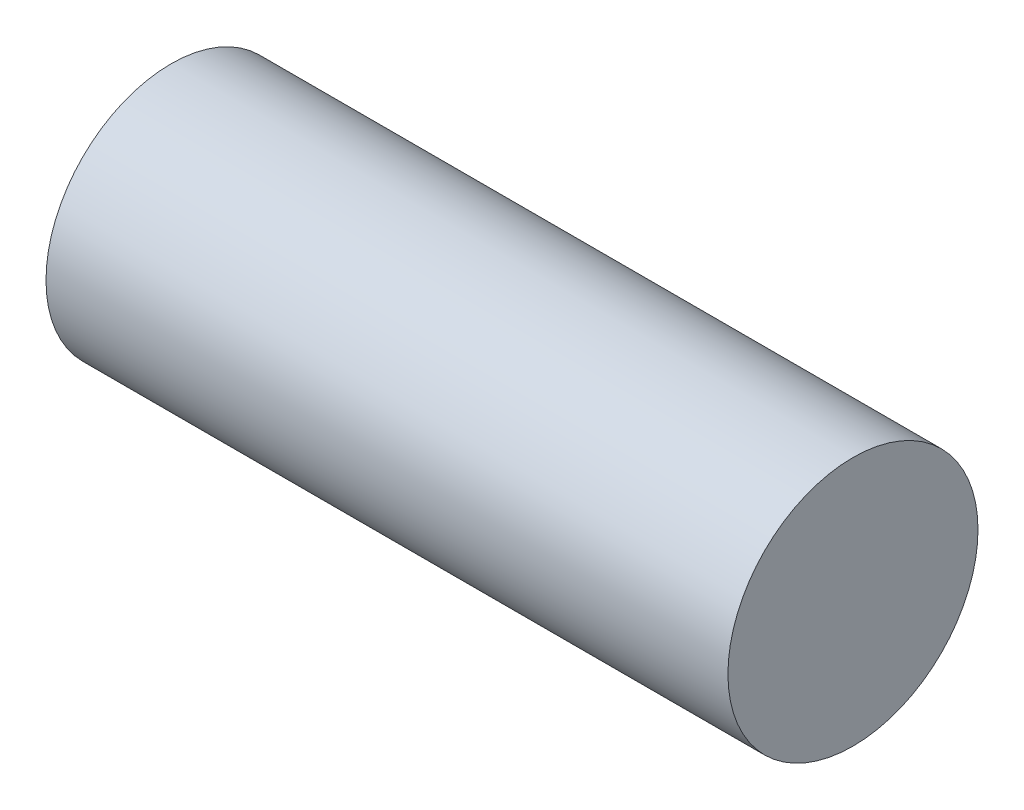
from build123d import *

# Parameters (mm, degrees)
SKETCH1_R           = 38.1
BOSS_EXTRUDE1_DEPTH = 210
CUT_EXTRUDE1_START  = -2.2
SKETCH2_R           = 38.1
CUT_EXTRUDE1_DEPTH  = 2.2


with BuildPart() as part:
    # Sketch1 → Boss-Extrude1 (new body)
    with BuildSketch(Plane(origin=(0, 0, 0), x_dir=(0, 0, -1), z_dir=(1, 0, 0))):
        Circle(SKETCH1_R)
    extrude(amount=BOSS_EXTRUDE1_DEPTH)

    # Sketch2 → Cut-Extrude1 (cut)
    with BuildSketch(Plane.ZY.offset(CUT_EXTRUDE1_START)):
        with Locations(Location((0, 0, 0), (0, 0, 90))):
            Circle(SKETCH2_R)
    extrude(amount=CUT_EXTRUDE1_DEPTH, mode=Mode.SUBTRACT)


solid = part.part
